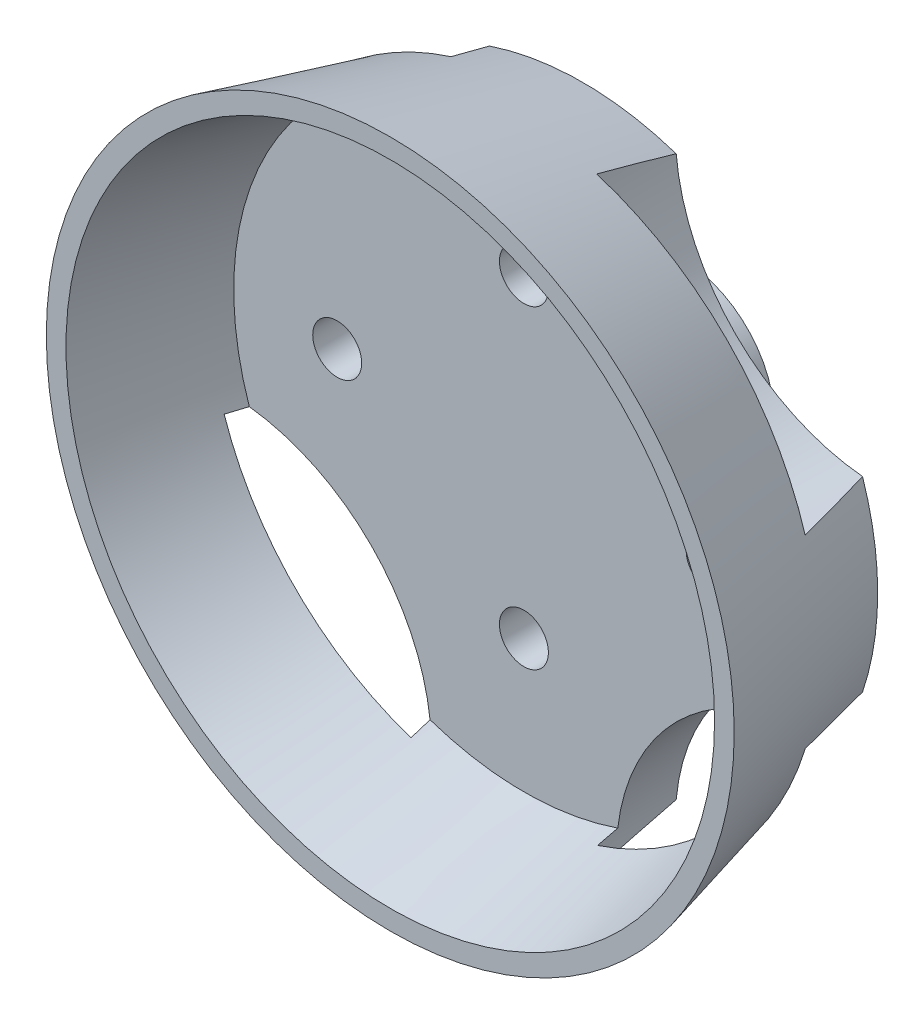
from build123d import *

# Parameters (mm, degrees)
SKETCH_2_R          = 1.245
SKETCH_2_R_2        = 10.5
CUT_EXTRUDE_1_DEPTH = 4
SKETCH_3_R          = 10.5
CUT_EXTRUDE_2_DEPTH = 2


with BuildPart() as part:
    # Эскиз1 → Повернуть1 (revolve)
    with BuildSketch(Plane(origin=(0, 0, 0), x_dir=(0, 0, -1), z_dir=(1, 0, 0)), mode=Mode.PRIVATE) as revolve_1_sk:
        Polygon((0, 0), (8, 0), (8, 4.75), (3, 4.75), (3, 15), (-6.8, 17.5), (-6.8, 16.5), (0, 14.765306122), align=None)
    revolve(revolve_1_sk.sketch.rotate(Axis((0, 0, 0), (0, 0, -1)), 90), axis=Axis((0, 0, 0), (0, 0, -1)))

    # Эскиз2 → Вырез-Вытянуть1 (cut)
    with BuildSketch(Plane(origin=(0, 0, -3), x_dir=(-1, 0, 0), z_dir=(0, 0, -1))):
        with Locations((0, 8)):
            Circle(SKETCH_2_R)
        with Locations((0, -8)):
            Circle(SKETCH_2_R)
        with Locations((9.5, 0)):
            Circle(SKETCH_2_R)
        with Locations((-9.5, 0)):
            Circle(SKETCH_2_R)
        with Locations((-15.202795796, -15.202795796)):
            Circle(SKETCH_2_R_2)
        with Locations((-15.202795796, 15.202795796)):
            Circle(SKETCH_2_R_2)
        with Locations((15.202795796, -15.202795796)):
            Circle(SKETCH_2_R_2)
    extrude(amount=-CUT_EXTRUDE_1_DEPTH, mode=Mode.SUBTRACT)

    # Эскиз3 → Вырез-Вытянуть2 (cut)
    with BuildSketch(Plane(origin=(0, 0, -3), x_dir=(-1, 0, 0), z_dir=(0, 0, -1))):
        with Locations((15.202795796, 15.202795796)):
            Circle(SKETCH_3_R)
    extrude(amount=-CUT_EXTRUDE_2_DEPTH, mode=Mode.SUBTRACT)


solid = part.part
